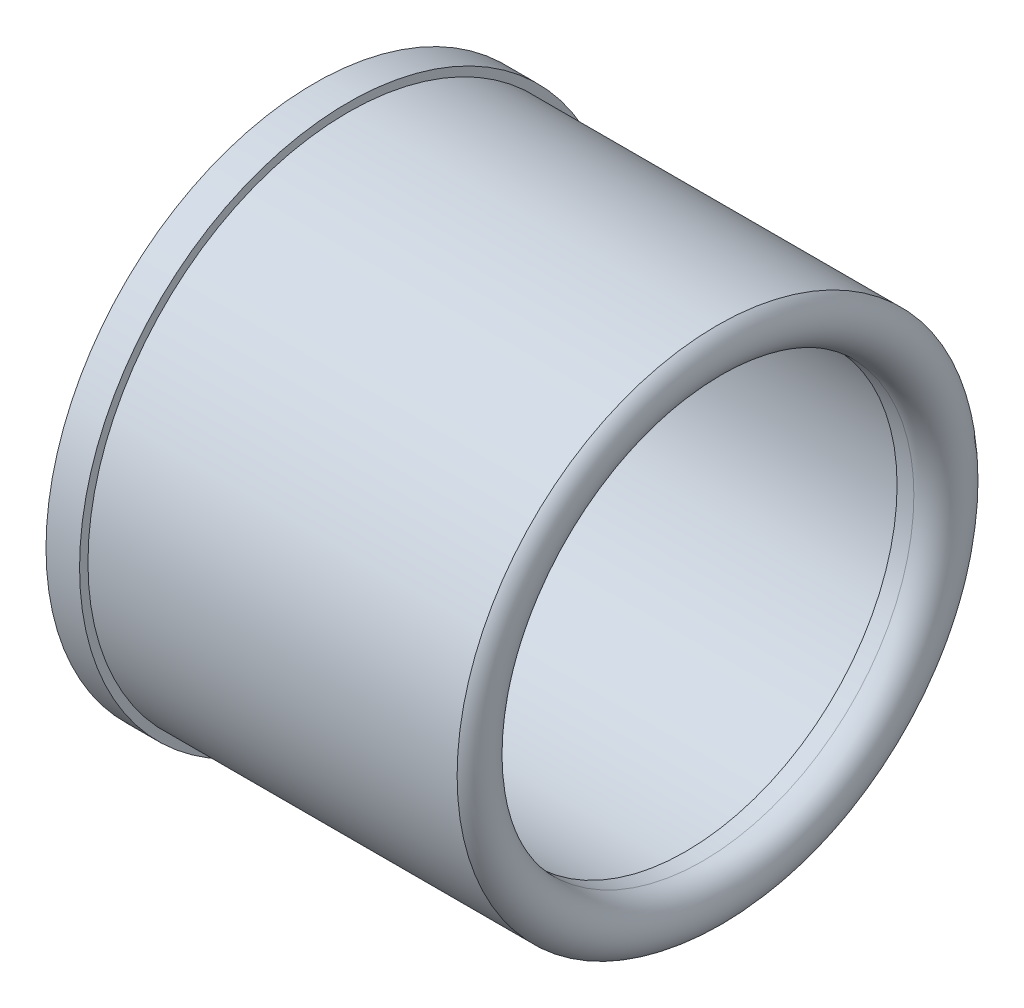
from build123d import *


with BuildPart() as part:
    # Sketch1 → Revolve1 (revolve)
    with BuildSketch(Plane(origin=(0, 0, 0), x_dir=(-1, 0, 0), z_dir=(0, 0, -1)), mode=Mode.PRIVATE) as revolve1_sk:
        with BuildLine():
            Line((-11.972812665, -2.233263235), (-11.972812665, -1.983263235))
            Line((-11.972812665, -1.983263235), (-0.912123334, -1.983263235))
            Line((-0.912123334, -1.983263235), (-0.912123334, -0.533263235))
            Line((-0.912123334, -0.533263235), (-1.912123334, -0.533263235))
            Line((-1.912123334, -0.533263235), (-1.912123334, -0.783263235))
            Line((-1.912123334, -0.783263235), (-12.912123334, -0.783263235))
            ThreePointArc((-12.912123334, -0.783263235), (-13.230357031, -1.671229021), (-12.472812665, -2.233263235))
            Line((-12.472812665, -2.233263235), (-11.972812665, -2.233263235))
        make_face()
    revolve(revolve1_sk.sketch.rotate(Axis((12.175741694, -8.533263235, 0), (-1, 0, 0)), 270), axis=Axis((12.175741694, -8.533263235, 0), (-1, 0, 0)))


solid = part.part
